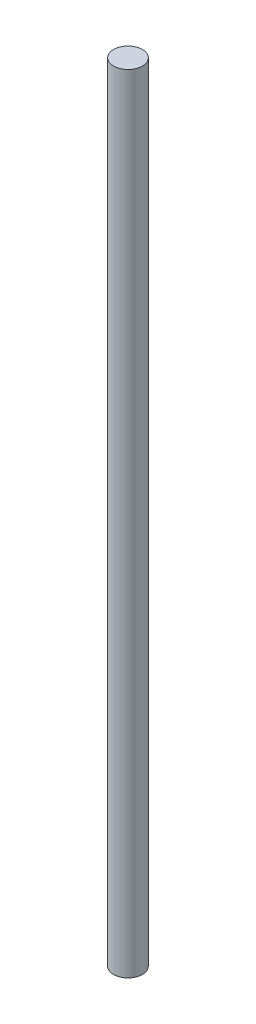
from build123d import *

# Parameters (mm, degrees)
SKETCH1_R           = 2.032
BOSS_EXTRUDE1_DEPTH = 55.499


with BuildPart() as part:
    # Sketch1 → Boss-Extrude1 (new, symmetric)
    with BuildSketch(Plane(origin=(0, 0, 0), x_dir=(1, 0, 0), z_dir=(0, 1, 0))):
        with Locations(Location((0, 0, 0), (0, 0, 270))):
            Circle(SKETCH1_R)
    extrude(amount=BOSS_EXTRUDE1_DEPTH, both=True)


solid = part.part
